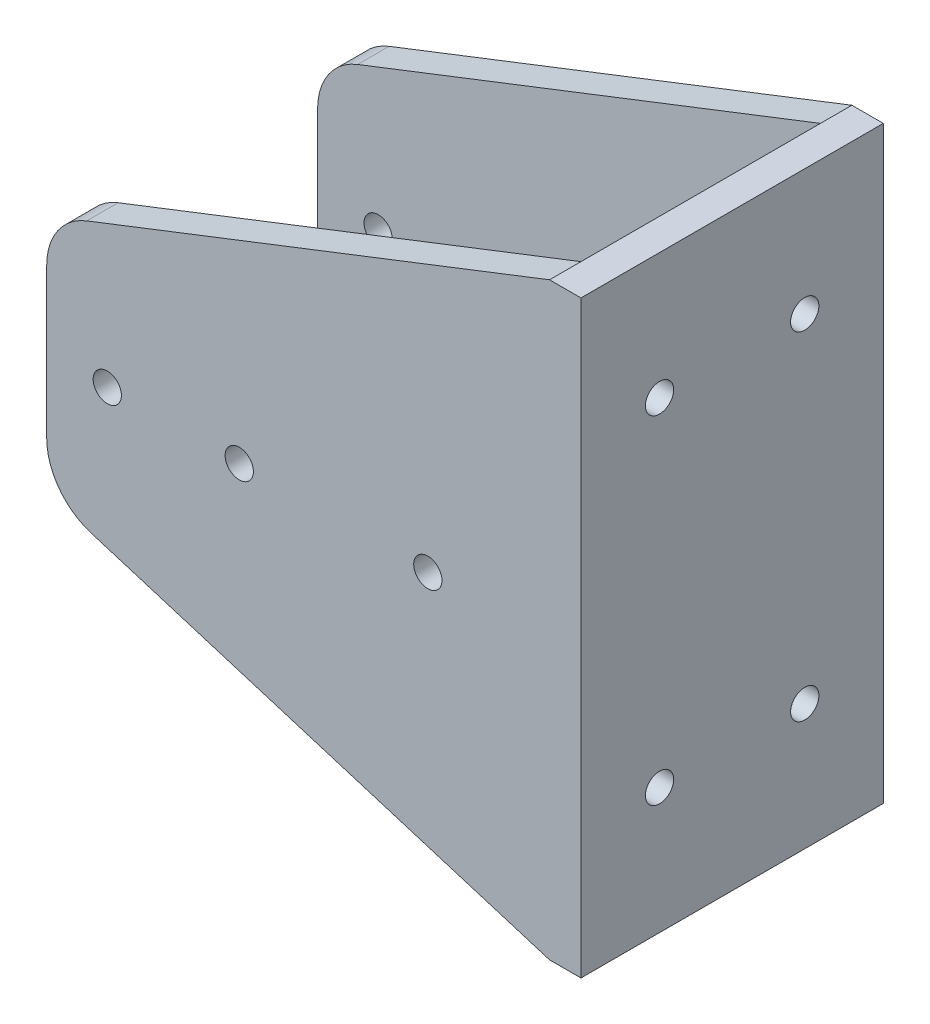
from build123d import *

# Parameters (mm, degrees)
SKETCH1_R           = 2.25
BOSS_EXTRUDE1_DEPTH = 5
SKETCH2_W           = 48.1
SKETCH2_H           = 93.7
SKETCH2_R           = 2.25
BOSS_EXTRUDE2_DEPTH = 5
BOSS_EXTRUDE3_START = -5
SKETCH3_R           = 2.25
BOSS_EXTRUDE3_DEPTH = 5


with BuildPart() as part:
    # Sketch1 → Boss-Extrude1 (new body)
    with BuildSketch(Plane.XY):
        with BuildLine():
            Line((-52.1605695, -11.804270746), (-52.1605695, 11.984503151))
            ThreePointArc((-52.1605695, 11.984503151), (-50.416314539, 17.627434468), (-45.792034729, 21.301823597))
            Line((-45.792034729, 21.301823597), (27.8394305, 50))
            Line((27.8394305, 50), (27.8394305, -43.667964744))
            Line((27.8394305, -43.667964744), (-45.084961564, -21.367111906))
            ThreePointArc((-45.084961564, -21.367111906), (-50.199348034, -17.752214901), (-52.1605695, -11.804270746))
        make_face()
        with Locations((-42.523814383, 0)):
            Circle(SKETCH1_R, mode=Mode.SUBTRACT)
        with Locations((-21.523814383, 0)):
            Circle(SKETCH1_R, mode=Mode.SUBTRACT)
        with Locations((8.476185617, 0)):
            Circle(SKETCH1_R, mode=Mode.SUBTRACT)
    extrude(amount=BOSS_EXTRUDE1_DEPTH)

    # Sketch2 → Boss-Extrude2 (add)
    with BuildSketch(Plane(origin=(27.8394305, 0, 0), x_dir=(0, 0, -1), z_dir=(1, 0, 0))):
        with Locations((-24.05, 3.15)):
            Rectangle(SKETCH2_W, SKETCH2_H)
        with Locations(Location((-35.6, 30, 0), (0, 0, 90))):
            Circle(SKETCH2_R, mode=Mode.SUBTRACT)
        with Locations(Location((-12.5, 30, 0), (0, 0, 90))):
            Circle(SKETCH2_R, mode=Mode.SUBTRACT)
        with Locations(Location((-35.6, -23.7, 0), (0, 0, 90))):
            Circle(SKETCH2_R, mode=Mode.SUBTRACT)
        with Locations(Location((-12.5, -23.7, 0), (0, 0, 90))):
            Circle(SKETCH2_R, mode=Mode.SUBTRACT)
    extrude(amount=BOSS_EXTRUDE2_DEPTH)

    # Sketch3 → Boss-Extrude3 (add)
    with BuildSketch(Plane.XY.offset(48.1).offset(BOSS_EXTRUDE3_START)):
        with BuildLine():
            Line((27.8394305, 50), (-45.792034729, 21.301823597))
            ThreePointArc((-45.792034729, 21.301823597), (-50.416314539, 17.627434468), (-52.1605695, 11.984503151))
            Line((-52.1605695, 11.984503151), (-52.1605695, -11.804270746))
            ThreePointArc((-52.1605695, -11.804270746), (-50.199348034, -17.752214901), (-45.084961564, -21.367111906))
            Line((-45.084961564, -21.367111906), (27.8394305, -43.7))
            Line((27.8394305, -43.7), (27.8394305, 50))
        make_face()
        with Locations((-21.523814383, 0)):
            Circle(SKETCH3_R, mode=Mode.SUBTRACT)
        with Locations((-42.523814383, 0)):
            Circle(SKETCH3_R, mode=Mode.SUBTRACT)
        with Locations((8.476185617, 0)):
            Circle(SKETCH3_R, mode=Mode.SUBTRACT)
    extrude(amount=BOSS_EXTRUDE3_DEPTH)


solid = part.part
